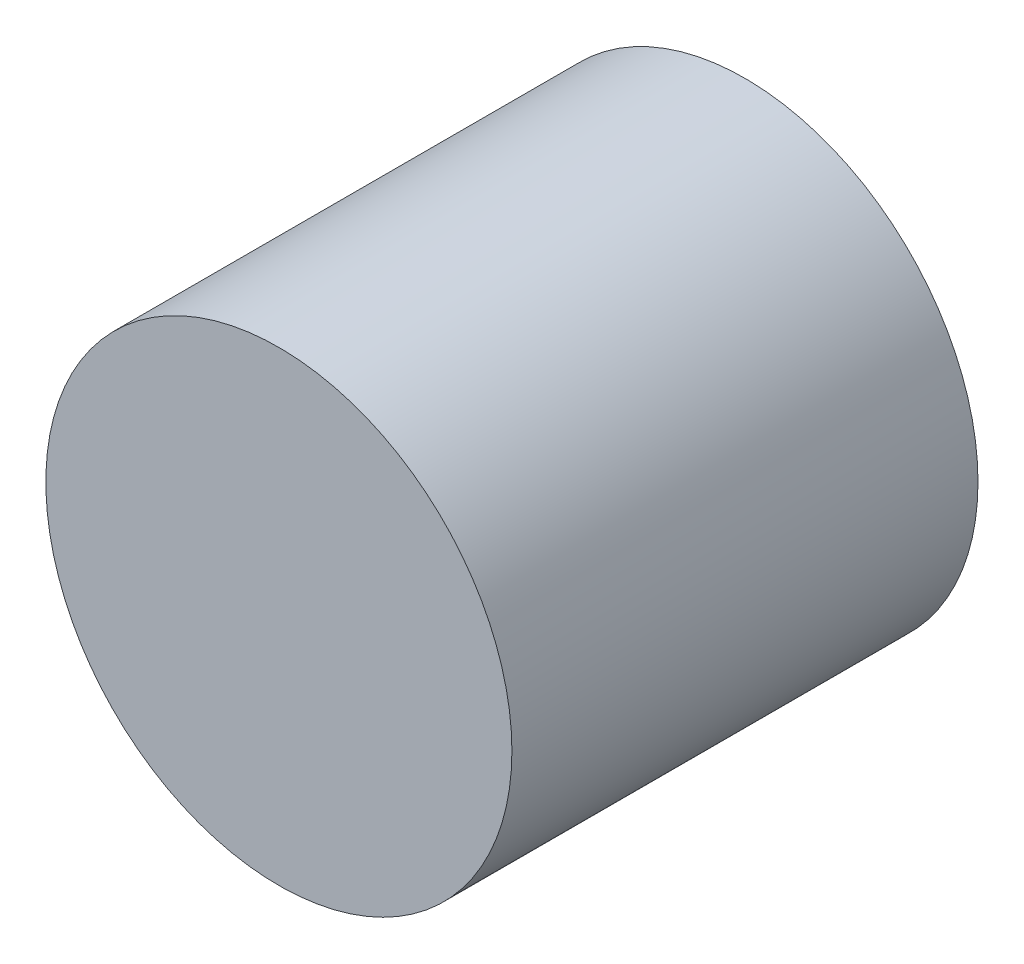
from build123d import *

# Parameters (mm, degrees)
ESBO_O1_R                = 1
RESSALTO_EXTRUS_O1_DEPTH = 2


with BuildPart() as part:
    # Esboço1 → Ressalto-extrusão1 (new body)
    with BuildSketch(Plane.XY):
        Circle(ESBO_O1_R)
    extrude(amount=RESSALTO_EXTRUS_O1_DEPTH)


solid = part.part
